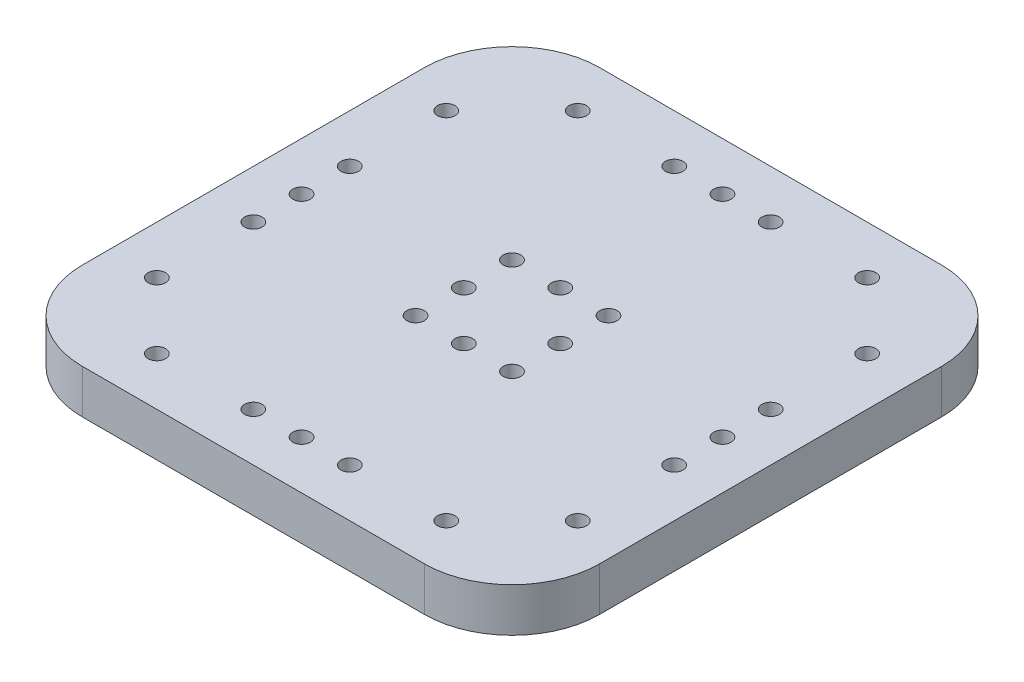
from build123d import *

# Parameters (mm, degrees)
SKETCH1_W           = 118
SKETCH1_H           = 118
SKETCH1_R           = 2
BOSS_EXTRUDE1_DEPTH = 10
FILLET1_R           = 20


with BuildPart() as part:
    # Sketch1 → Boss-Extrude1 (new body)
    with BuildSketch(Plane(origin=(0, 0, 0), x_dir=(1, 0, 0), z_dir=(0, 1, 0))):
        with Locations((-1.371006445, 1.121732546)):
            Rectangle(SKETCH1_W, SKETCH1_H)
        with Locations(Location((-1.371006445, -46.878267454, 0), (0, 0, 270))):
            Circle(SKETCH1_R, mode=Mode.SUBTRACT)
        with Locations(Location((9.628993555, -46.878267454, 0), (0, 0, 270))):
            Circle(SKETCH1_R, mode=Mode.SUBTRACT)
        with Locations(Location((31.628993555, -46.878267454, 0), (0, 0, 270))):
            Circle(SKETCH1_R, mode=Mode.SUBTRACT)
        with Locations(Location((-34.371006445, -46.878267454, 0), (0, 0, 90))):
            Circle(SKETCH1_R, mode=Mode.SUBTRACT)
        with Locations(Location((-12.371006445, -46.878267454, 0), (0, 0, 90))):
            Circle(SKETCH1_R, mode=Mode.SUBTRACT)
        with Locations(Location((-1.371006445, -9.878267454, 0), (0, 0, 270))):
            Circle(SKETCH1_R, mode=Mode.SUBTRACT)
        with Locations(Location((9.628993555, -9.878267454, 0), (0, 0, 270))):
            Circle(SKETCH1_R, mode=Mode.SUBTRACT)
        with Locations(Location((-12.371006445, -9.878267454, 0), (0, 0, 90))):
            Circle(SKETCH1_R, mode=Mode.SUBTRACT)
        with Locations(Location((-12.371006445, 1.121732546, 0), (0, 0, 270))):
            Circle(SKETCH1_R, mode=Mode.SUBTRACT)
        with Locations(Location((-12.371006445, 12.121732546, 0), (0, 0, 270))):
            Circle(SKETCH1_R, mode=Mode.SUBTRACT)
        with Locations(Location((9.628993555, 12.121732546, 0), (0, 0, 90))):
            Circle(SKETCH1_R, mode=Mode.SUBTRACT)
        with Locations(Location((-1.371006445, 12.121732546, 0), (0, 0, 90))):
            Circle(SKETCH1_R, mode=Mode.SUBTRACT)
        with Locations(Location((-12.371006445, 49.121732546, 0), (0, 0, 270))):
            Circle(SKETCH1_R, mode=Mode.SUBTRACT)
        with Locations(Location((-34.371006445, 49.121732546, 0), (0, 0, 270))):
            Circle(SKETCH1_R, mode=Mode.SUBTRACT)
        with Locations(Location((31.628993555, 49.121732546, 0), (0, 0, 90))):
            Circle(SKETCH1_R, mode=Mode.SUBTRACT)
        with Locations(Location((9.628993555, 49.121732546, 0), (0, 0, 90))):
            Circle(SKETCH1_R, mode=Mode.SUBTRACT)
        with Locations(Location((-1.371006445, 49.121732546, 0), (0, 0, 90))):
            Circle(SKETCH1_R, mode=Mode.SUBTRACT)
        with Locations(Location((9.628993555, 1.121732546, 0), (0, 0, 90))):
            Circle(SKETCH1_R, mode=Mode.SUBTRACT)
        with Locations(Location((46.628993555, 12.121732546, 0), (0, 0, 270))):
            Circle(SKETCH1_R, mode=Mode.SUBTRACT)
        with Locations(Location((46.628993555, 34.121732546, 0), (0, 0, 270))):
            Circle(SKETCH1_R, mode=Mode.SUBTRACT)
        with Locations(Location((46.628993555, -31.878267454, 0), (0, 0, 90))):
            Circle(SKETCH1_R, mode=Mode.SUBTRACT)
        with Locations(Location((46.628993555, -9.878267454, 0), (0, 0, 90))):
            Circle(SKETCH1_R, mode=Mode.SUBTRACT)
        with Locations(Location((46.628993555, 1.121732546, 0), (0, 0, 90))):
            Circle(SKETCH1_R, mode=Mode.SUBTRACT)
        with Locations(Location((-49.371006445, 1.121732546, 0), (0, 0, 270))):
            Circle(SKETCH1_R, mode=Mode.SUBTRACT)
        with Locations(Location((-49.371006445, -9.878267454, 0), (0, 0, 270))):
            Circle(SKETCH1_R, mode=Mode.SUBTRACT)
        with Locations(Location((-49.371006445, -31.878267454, 0), (0, 0, 270))):
            Circle(SKETCH1_R, mode=Mode.SUBTRACT)
        with Locations(Location((-49.371006445, 34.121732546, 0), (0, 0, 90))):
            Circle(SKETCH1_R, mode=Mode.SUBTRACT)
        with Locations(Location((-49.371006445, 12.121732546, 0), (0, 0, 90))):
            Circle(SKETCH1_R, mode=Mode.SUBTRACT)
    extrude(amount=BOSS_EXTRUDE1_DEPTH)

    # Fillet1
    fillet1_edges = [part.edges().sort_by_distance(p)[0] for p in [
        (-60.371006445, 5, -60.121732546),
        (57.628993555, 5, -60.121732546),
        (57.628993555, 5, 57.878267454),
        (-60.371006445, 5, 57.878267454),
    ]]
    fillet(fillet1_edges, radius=FILLET1_R)


solid = part.part
